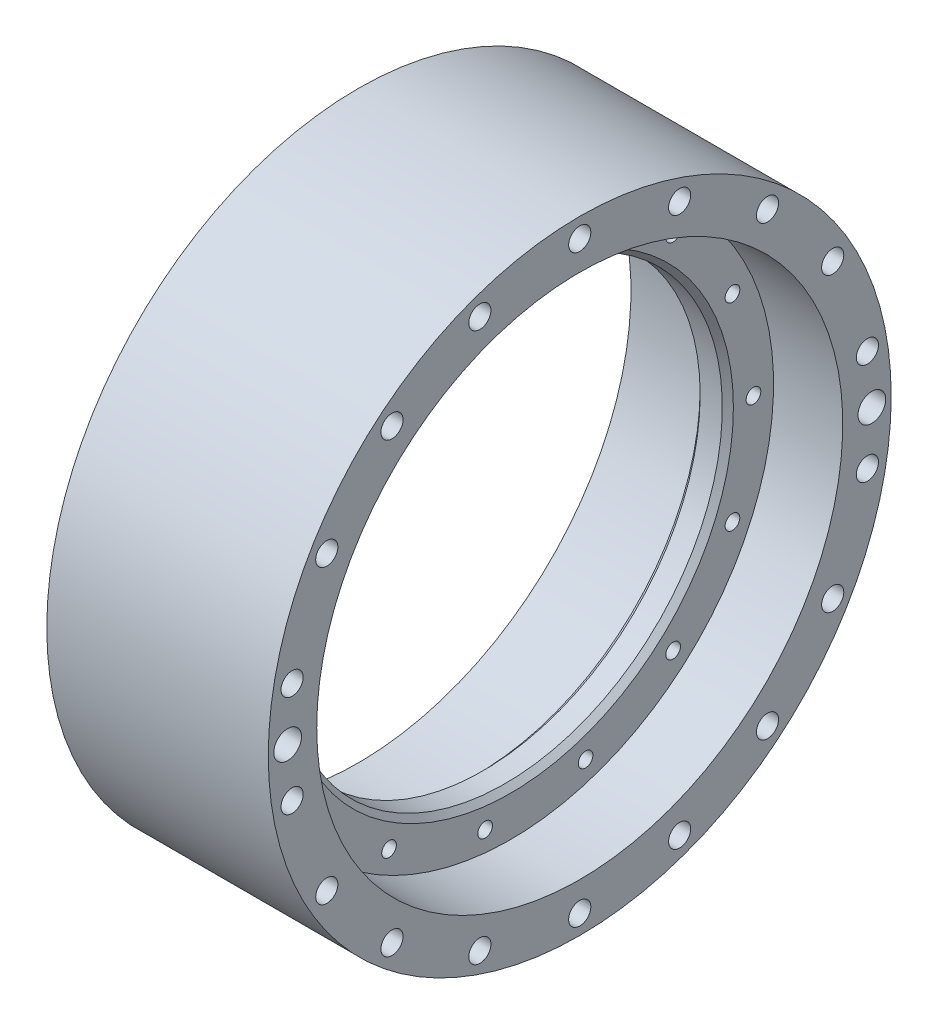
from build123d import *

# Parameters (mm, degrees)
F_8_0MM_DOWEL_HOLE1_D = 8
CIRPATTERN1_COUNT     = 18
SKETCH4_R             = 5
CUT_EXTRUDE1_DEPTH    = 179.080038185
SKETCH5_R             = 2.65
CUT_EXTRUDE2_DEPTH    = 169.337458695
CIRPATTERN2_COUNT     = 15
CHAMFER1_SIZE         = 2


with BuildPart() as part:
    # Sketch1 → Revolve1 (revolve)
    with BuildSketch(Plane.XY):
        Polygon((0, 112.5), (80, 112.5), (80, 95), (55, 95), (55, 78.5), (43, 78.5), (43, 98.5), (0, 98.5), align=None)
    revolve(axis=Axis((0, 0, 0), (1, 0, 0)))

    # Ø8.0mm Dowel Hole1 (through all)
    with Locations(Plane(origin=(0, 105.5, 0), x_dir=(0, 0, -1), z_dir=(-1, 0, 0))):
        with Locations((0, 0)):
            f_8_0mm_dowel_hole1 = Hole(F_8_0MM_DOWEL_HOLE1_D / 2)

    # CirPattern1: Ø8.0mm Dowel Hole1 ×18 about axis
    cirpattern1_axis = Axis((80, 0, 0), (-1, 0, 0))
    for i in range(1, CIRPATTERN1_COUNT):
        add(f_8_0mm_dowel_hole1.rotate(cirpattern1_axis, i * 360 / CIRPATTERN1_COUNT), mode=Mode.SUBTRACT)

    # Sketch4 → Cut-Extrude1 (cut, through all)
    with BuildSketch(Plane.ZY):
        with Locations((105.5, 0)):
            Circle(SKETCH4_R)
        with Locations((-105.5, 0)):
            Circle(SKETCH4_R)
    extrude(amount=-CUT_EXTRUDE1_DEPTH, mode=Mode.SUBTRACT)

    # Sketch5 → Cut-Extrude2 (cut, through all)
    with BuildSketch(Plane(origin=(55, 0, 0), x_dir=(0, 0, -1), z_dir=(1, 0, 0))):
        with Locations((87.75, 0)):
            Circle(SKETCH5_R)
    cut_extrude2 = extrude(amount=-CUT_EXTRUDE2_DEPTH, mode=Mode.SUBTRACT)

    # CirPattern2: Cut-Extrude2 ×15 about axis
    cirpattern2_axis = Axis((80, 0, 0), (-1, 0, 0))
    for i in range(1, CIRPATTERN2_COUNT):
        add(cut_extrude2.rotate(cirpattern2_axis, i * 360 / CIRPATTERN2_COUNT), mode=Mode.SUBTRACT)

    # Chamfer1
    chamfer1_edges = [part.edges().sort_by_distance(p)[0] for p in [
        (43, -78.5, 0),
        (55, -78.5, 0),
    ]]
    chamfer(chamfer1_edges, length=CHAMFER1_SIZE)


solid = part.part
